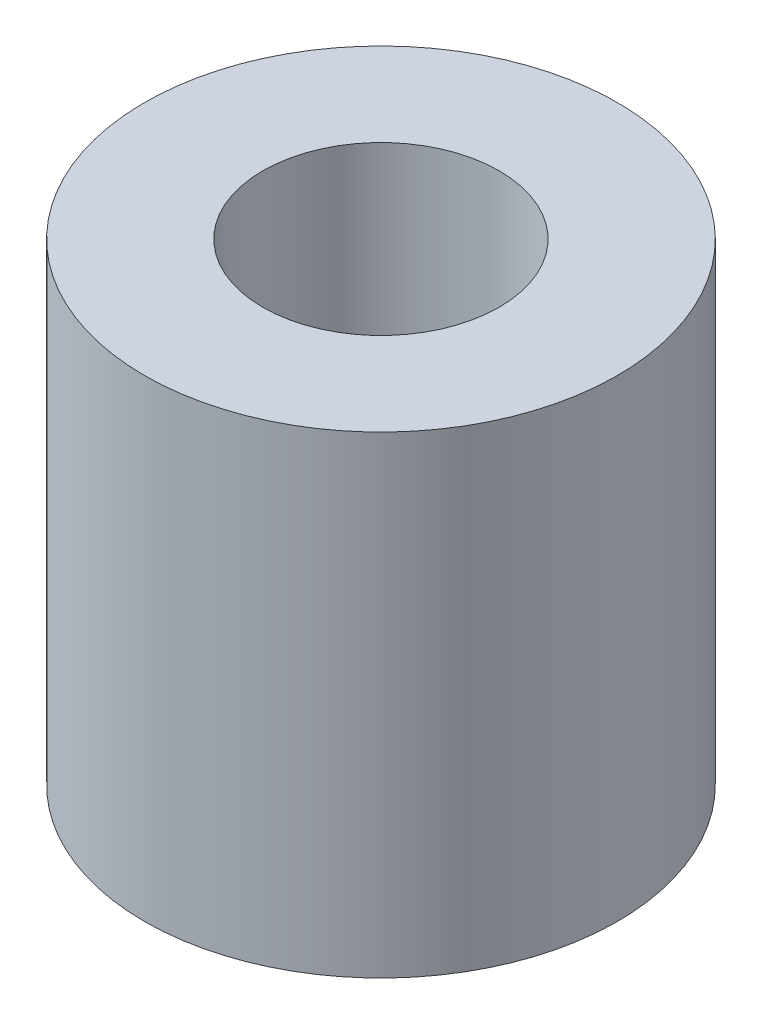
from build123d import *

# Parameters (mm, degrees)
SKETCH_1_R      = 2
SKETCH_1_R_2    = 1
EXTRUDE_1_DEPTH = 4


with BuildPart() as part:
    # 草图1 → 凸台-拉伸1 (new body)
    with BuildSketch(Plane(origin=(0, 0, 0), x_dir=(1, 0, 0), z_dir=(0, 1, 0))):
        with Locations(Location((0, 0, 0), (0, 0, 270))):
            Circle(SKETCH_1_R)
        with Locations(Location((0, 0, 0), (0, 0, 270))):
            Circle(SKETCH_1_R_2, mode=Mode.SUBTRACT)
    extrude(amount=EXTRUDE_1_DEPTH)


solid = part.part
